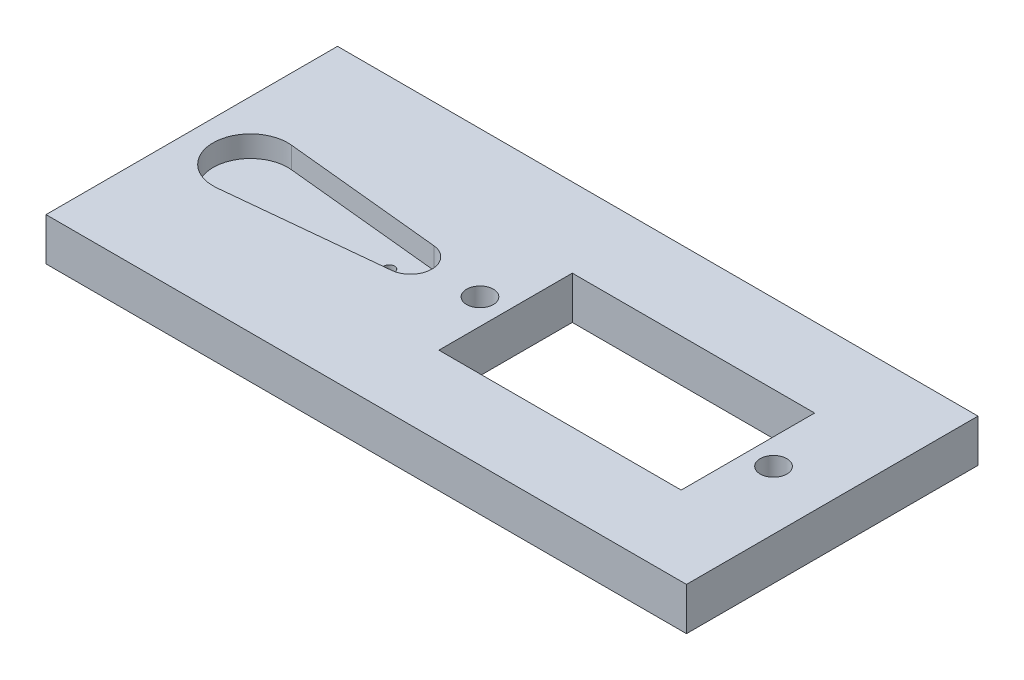
from build123d import *

# Parameters (mm, degrees)
SKETCH_1_W      = 60
SKETCH_1_H      = 27.309222572
SKETCH_1_R      = 1.25
SKETCH_1_W_2    = 22.7
SKETCH_1_H_2    = 12.5
EXTRUDE_2_DEPTH = 4
SKETCH_1_4_R    = 0.5
EXTRUDE_3_DEPTH = 2


with BuildPart() as part:
    # 草图1 → 凸台-拉伸2 (new body)
    with BuildSketch(Plane(origin=(0, 0, 0), x_dir=(1, 0, 0), z_dir=(0, 1, 0))):
        Rectangle(SKETCH_1_W, SKETCH_1_H)
        with BuildLine():
            ThreePointArc((-24.15, -3.48245603), (-28, 0), (-24.15, 3.48245603))
            Line((-24.15, 3.48245603), (-9.3, 1.989974874))
            ThreePointArc((-9.3, 1.989974874), (-8.016760303, 1.341640786), (-7.5, 0))
            ThreePointArc((-7.5, 0), (-8.016760303, -1.341640786), (-9.3, -1.989974874))
            Line((-9.3, -1.989974874), (-24.15, -3.48245603))
        make_face(mode=Mode.SUBTRACT)
        with Locations((-3, 0)):
            Circle(SKETCH_1_R, mode=Mode.SUBTRACT)
        with Locations((10.75, 0)):
            Rectangle(SKETCH_1_W_2, SKETCH_1_H_2, mode=Mode.SUBTRACT)
        with Locations((24.5, 0)):
            Circle(SKETCH_1_R, mode=Mode.SUBTRACT)
    extrude(amount=EXTRUDE_2_DEPTH)

    # 草图1<4> → 凸台-拉伸3 (add)
    with BuildSketch(Plane(origin=(0, 0, 0), x_dir=(1, 0, 0), z_dir=(0, 1, 0))):
        with BuildLine():
            Line((-9.3, 1.989974874), (-24.15, 3.48245603))
            ThreePointArc((-24.15, 3.48245603), (-28, 0), (-24.15, -3.48245603))
            Line((-24.15, -3.48245603), (-9.3, -1.989974874))
            ThreePointArc((-9.3, -1.989974874), (-7.5, 0), (-9.3, 1.989974874))
        make_face()
        with Locations((-11.5, 0)):
            Circle(SKETCH_1_4_R, mode=Mode.SUBTRACT)
    extrude(amount=EXTRUDE_3_DEPTH)


solid = part.part
